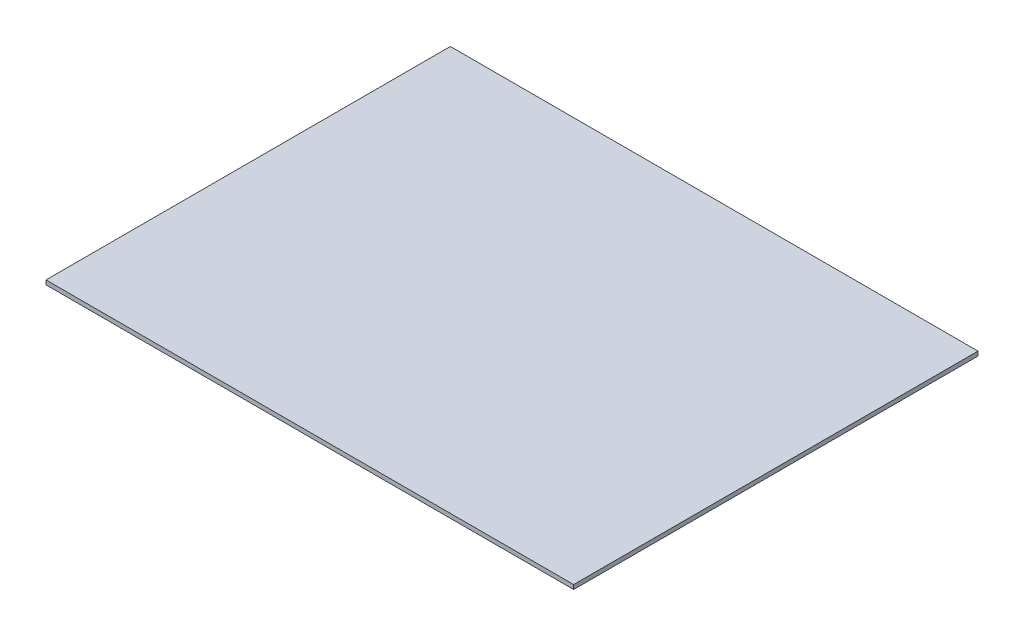
from build123d import *

# Parameters (mm, degrees)
SKETCH1_W           = 184
SKETCH1_H           = 141
BOSS_EXTRUDE1_DEPTH = 1.5


with BuildPart() as part:
    # Sketch1 → Boss-Extrude1 (new body)
    with BuildSketch(Plane(origin=(0, 0, 0), x_dir=(1, 0, 0), z_dir=(0, 1, 0))):
        Rectangle(SKETCH1_W, SKETCH1_H)
    extrude(amount=BOSS_EXTRUDE1_DEPTH)


solid = part.part
